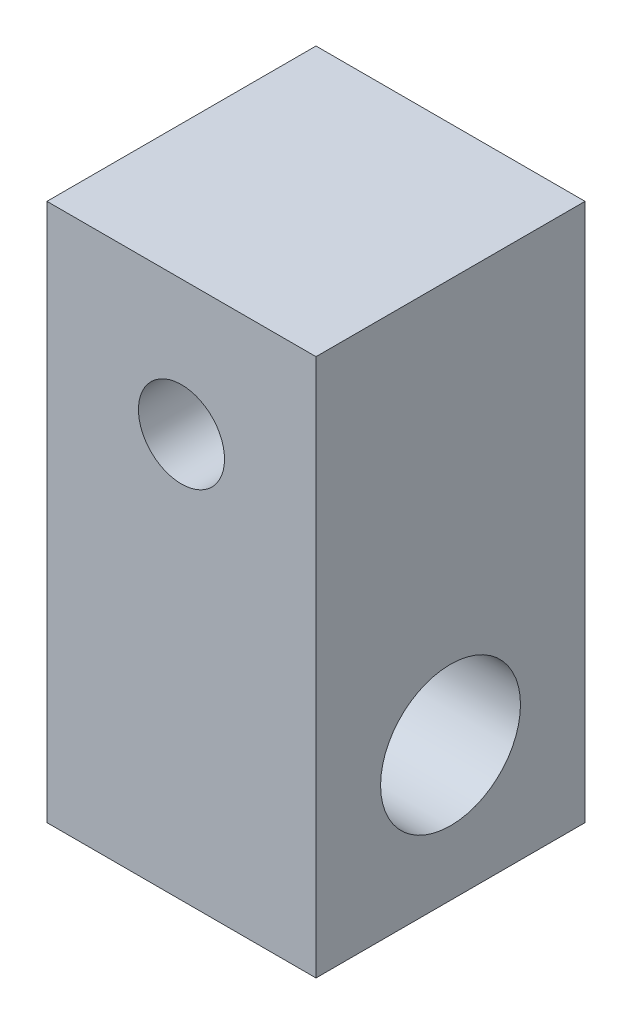
from build123d import *

# Parameters (mm, degrees)
SKETCH_1_W          = 10
SKETCH_1_H          = 20
EXTRUDE_1_DEPTH     = 10
SKETCH_2_R          = 2.6
CUT_EXTRUDE_1_DEPTH = 25.494897428
SKETCH_3_R          = 1.6
CUT_EXTRUDE_2_DEPTH = 10


with BuildPart() as part:
    # ｽｹｯﾁ1 → ﾎﾞｽ - 押し出し1 (new body)
    with BuildSketch(Plane.XY):
        with Locations((5, 10)):
            Rectangle(SKETCH_1_W, SKETCH_1_H)
    extrude(amount=EXTRUDE_1_DEPTH)

    # ｽｹｯﾁ2 → ｶｯﾄ - 押し出し1 (cut, through all)
    with BuildSketch(Plane(origin=(10, 0, 0), x_dir=(0, 0, -1), z_dir=(1, 0, 0))):
        with Locations(Location((-5, 5, 0), (0, 0, 90))):
            Circle(SKETCH_2_R)
    extrude(amount=-CUT_EXTRUDE_1_DEPTH, mode=Mode.SUBTRACT)

    # ｽｹｯﾁ3 → ｶｯﾄ - 押し出し2 (cut)
    with BuildSketch(Plane.XY.offset(10)):
        with Locations((5, 15)):
            Circle(SKETCH_3_R)
    extrude(amount=-CUT_EXTRUDE_2_DEPTH, mode=Mode.SUBTRACT)


solid = part.part
